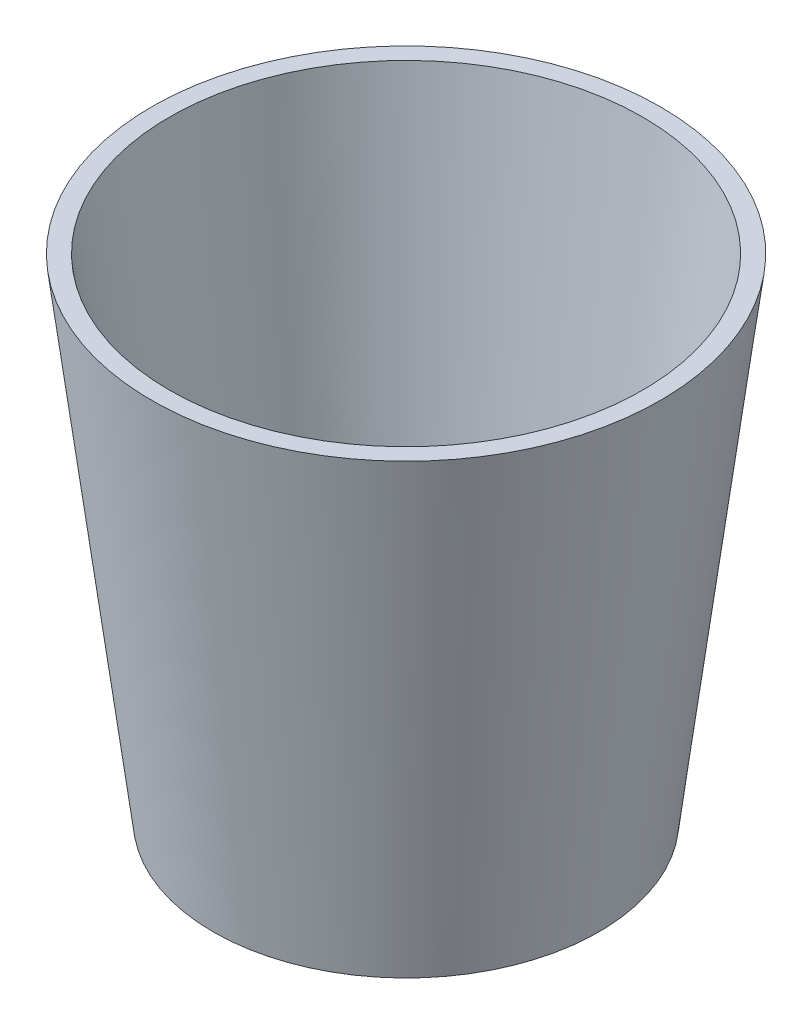
from build123d import *


with BuildPart() as part:
    # Sketch1 → Revolve1 (revolve)
    with BuildSketch(Plane(origin=(0, 0, 0), x_dir=(0, 0, -1), z_dir=(1, 0, 0)), mode=Mode.PRIVATE) as revolve1_sk:
        Polygon((0, 0), (-30, 0), (-40, 80), (-43, 80), (-32.625, -3), (0, -3), align=None)
    revolve(revolve1_sk.sketch.rotate(Axis((0, 0, 0), (0, 1, 0)), 180), axis=Axis((0, 0, 0), (0, 1, 0)))


solid = part.part
